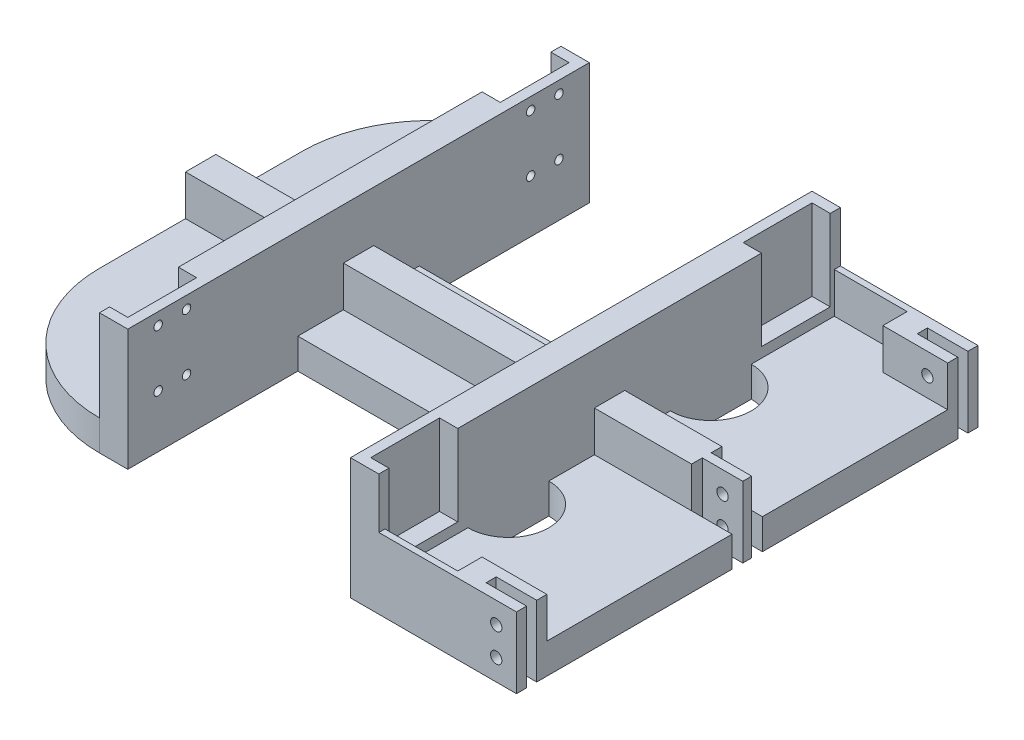
from build123d import *

# Parameters (mm, degrees)
BOSS_EXTRUDE1_DEPTH      = 2.5
BOSS_EXTRUDE1_DEPTH_BACK = 5
SKETCH3_W                = 7
SKETCH3_H                = 22
BOSS_EXTRUDE2_DEPTH      = 2.5
BOSS_EXTRUDE3_DEPTH      = 20
SKETCH5_R                = 3.75
BOSS_EXTRUDE4_DEPTH      = 5.5
SKETCH8_R                = 1.05
CUT_EXTRUDE1_DEPTH       = 2.5
SKETCH10_W               = 125
SKETCH10_H               = 7.5
BOSS_EXTRUDE6_DEPTH      = 10
SKETCH11_W               = 2.5
SKETCH11_H               = 17.5
SKETCH11_W_2             = 2.2
BOSS_EXTRUDE7_DEPTH      = 10
SKETCH12_R               = 1.4
CUT_EXTRUDE3_DEPTH       = 114
SKETCH14_W               = 45.75
SKETCH14_H               = 7.5
BOSS_EXTRUDE8_DEPTH      = 10
SKETCH16_W               = 7
SKETCH16_H               = 30
BOSS_EXTRUDE9_DEPTH      = 70


with BuildPart() as part:
    # Sketch1 → Boss-Extrude1 (new, two sides: drawn at the far end of the back side and taken through both)
    with BuildSketch(Plane(origin=(0, 0, 0), x_dir=(1, 0, 0), z_dir=(0, 1, 0)).offset(-BOSS_EXTRUDE1_DEPTH_BACK)):
        with BuildLine():
            Line((-62.5, 25), (-62.5, -25))
            ThreePointArc((-62.5, -25), (-53.127416998, -47.627416998), (-30.5, -57))
            Line((-30.5, -57), (-23.5, -57))
            Line((-23.5, -57), (-23.5, -35))
            Line((-23.5, -35), (-30.5, -35))
            ThreePointArc((-30.5, -35), (-40.5, -25), (-30.5, -15))
            Line((-30.5, -15), (38.5, -15))
            ThreePointArc((38.5, -15), (48.5, -25), (38.5, -35))
            Line((38.5, -35), (31.5, -35))
            Line((31.5, -35), (31.5, -57))
            Line((31.5, -57), (38.5, -57))
            Line((38.5, -57), (62.5, -57))
            Line((62.5, -57), (62.5, 57))
            Line((62.5, 57), (38.5, 57))
            Line((38.5, 57), (31.5, 57))
            Line((31.5, 57), (31.5, 35))
            Line((31.5, 35), (38.5, 35))
            ThreePointArc((38.5, 35), (48.5, 25), (38.5, 15))
            Line((38.5, 15), (-30.5, 15))
            ThreePointArc((-30.5, 15), (-40.5, 25), (-30.5, 35))
            Line((-30.5, 35), (-23.5, 35))
            Line((-23.5, 35), (-23.5, 57))
            Line((-23.5, 57), (-30.5, 57))
            ThreePointArc((-30.5, 57), (-53.127416998, 47.627416998), (-62.5, 25))
        make_face()
    extrude(amount=BOSS_EXTRUDE1_DEPTH + BOSS_EXTRUDE1_DEPTH_BACK)

    # Sketch3 → Boss-Extrude2 (add)
    with BuildSketch(Plane(origin=(0, 2.5, 0), x_dir=(1, 0, 0), z_dir=(0, 1, 0))):
        with Locations((-27, 46)):
            Rectangle(SKETCH3_W, SKETCH3_H)
        with Locations((35, 46)):
            Rectangle(SKETCH3_W, SKETCH3_H)
        with Locations((35, -46)):
            Rectangle(SKETCH3_W, SKETCH3_H)
        with Locations((-27, -46)):
            Rectangle(SKETCH3_W, SKETCH3_H)
    extrude(amount=BOSS_EXTRUDE2_DEPTH)

    # Sketch4 → Boss-Extrude3 (add)
    with BuildSketch(Plane(origin=(0, 5, 0), x_dir=(1, 0, 0), z_dir=(0, 1, 0))):
        Polygon((38.5, -37.5), (38.5, -35), (31.5, -35), (31.5, -57), (38.5, -57), (38.5, -54.5), (34, -54.5), (34, -37.5), align=None)
        Polygon((-23.5, -57), (-23.5, -35), (-30.5, -35), (-30.5, -37.5), (-26, -37.5), (-26, -54.5), (-30.5, -54.5), (-30.5, -57), align=None)
        Polygon((31.5, 57), (31.5, 35), (38.5, 35), (38.5, 37.5), (34, 37.5), (34, 54.5), (38.5, 54.5), (38.5, 57), align=None)
        Polygon((-30.5, 37.5), (-30.5, 35), (-23.5, 35), (-23.5, 57), (-30.5, 57), (-30.5, 54.5), (-26, 54.5), (-26, 37.5), align=None)
    extrude(amount=BOSS_EXTRUDE3_DEPTH)

    # Sketch5 → Boss-Extrude4 (add)
    with BuildSketch(Plane.ZY.offset(-31.5)):
        with Locations((46, 13.75)):
            Circle(SKETCH5_R)
        with Locations((-46, 13.75)):
            Circle(SKETCH5_R)
    extrude(amount=BOSS_EXTRUDE4_DEPTH)

    # Sketch8 → Cut-Extrude1 (cut)
    with BuildSketch(Plane(origin=(-23.5, 0, 0), x_dir=(0, 0, -1), z_dir=(1, 0, 0))):
        with Locations((-42.5, 22)):
            Circle(SKETCH8_R)
        with Locations((-49.5, 22)):
            Circle(SKETCH8_R)
        with Locations((-49.5, 8)):
            Circle(SKETCH8_R)
        with Locations((-42.5, 8)):
            Circle(SKETCH8_R)
        with Locations((42.5, 8)):
            Circle(SKETCH8_R)
        with Locations((49.5, 8)):
            Circle(SKETCH8_R)
        with Locations((49.5, 22)):
            Circle(SKETCH8_R)
        with Locations((42.5, 22)):
            Circle(SKETCH8_R)
    extrude(amount=-CUT_EXTRUDE1_DEPTH, mode=Mode.SUBTRACT)

    # Sketch10 → Boss-Extrude6 (add)
    with BuildSketch(Plane(origin=(0, 2.5, 0), x_dir=(1, 0, 0), z_dir=(0, 1, 0))):
        Polygon((62.5, 49.5), (62.5, 57), (38.5, 57), (38.5, 55.5), (56.5, 55.5), (56.5, 49.5), align=None)
        Polygon((62.5, -57), (62.5, -49.5), (56.5, -49.5), (56.5, -55.5), (38.5, -55.5), (38.5, -57), align=None)
        Rectangle(SKETCH10_W, SKETCH10_H)
    extrude(amount=BOSS_EXTRUDE6_DEPTH)

    # Sketch11 → Boss-Extrude7 (add)
    with BuildSketch(Plane(origin=(62.5, 0, 0), x_dir=(0, 0, -1), z_dir=(1, 0, 0))):
        with Locations((55.75, 3.75)):
            Rectangle(SKETCH11_W, SKETCH11_H)
        with Locations((0, 3.75)):
            Rectangle(SKETCH11_W_2, SKETCH11_H)
        with Locations((50.75, 3.75)):
            Rectangle(SKETCH11_W, SKETCH11_H)
        with Locations((-50.75, 3.75)):
            Rectangle(SKETCH11_W, SKETCH11_H)
        with Locations((-55.75, 3.75)):
            Rectangle(SKETCH11_W, SKETCH11_H)
    extrude(amount=BOSS_EXTRUDE7_DEPTH)

    # Sketch12 → Cut-Extrude3 (cut)
    with BuildSketch(Plane(origin=(0, 0, -57), x_dir=(-1, 0, 0), z_dir=(0, 0, -1))):
        with Locations((-67.5, 7.25)):
            Circle(SKETCH12_R)
        with Locations((-67.5, 0.25)):
            Circle(SKETCH12_R)
    extrude(amount=-CUT_EXTRUDE3_DEPTH, mode=Mode.SUBTRACT)

    # Sketch14 → Boss-Extrude8 (add)
    with BuildSketch(Plane(origin=(62.5, 0, 0), x_dir=(0, 0, -1), z_dir=(1, 0, 0))):
        with Locations((-26.625, -1.25)):
            Rectangle(SKETCH14_W, SKETCH14_H)
        with Locations((26.625, -1.25)):
            Rectangle(SKETCH14_W, SKETCH14_H)
    extrude(amount=BOSS_EXTRUDE8_DEPTH)

    # Sketch16 → Boss-Extrude9 (add)
    with BuildSketch(Plane.XY.offset(-35)):
        with Locations((-27, 10)):
            Rectangle(SKETCH16_W, SKETCH16_H)
        with Locations((35, 10)):
            Rectangle(SKETCH16_W, SKETCH16_H)
    extrude(amount=BOSS_EXTRUDE9_DEPTH)


solid = part.part
